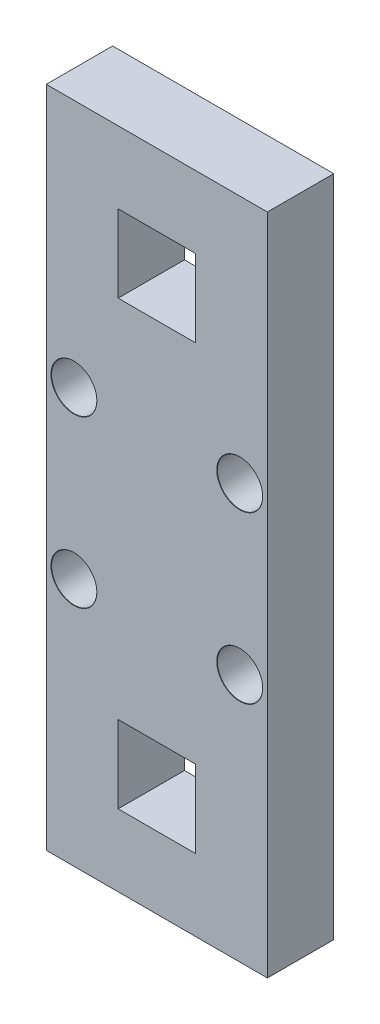
from build123d import *

# Parameters (mm, degrees)
SKETCH_1_W                        = 20
SKETCH_1_H                        = 60
EXTRUDE_1_DEPTH                   = 6
SKETCH_2_W                        = 7
SKETCH_2_H                        = 7
CUT_EXTRUDE_1_DEPTH               = 10
HOLE_WIZARD_4_1_4_1_1_D           = 4.1
HOLE_WIZARD_4_1_4_1_1_CSINK_D     = 4.15
HOLE_WIZARD_4_1_4_1_1_CSINK_ANGLE = 90


with BuildPart() as part:
    # 草图1 → 凸台-拉伸1 (new body)
    with BuildSketch(Plane.XY):
        Rectangle(SKETCH_1_W, SKETCH_1_H)
    extrude(amount=EXTRUDE_1_DEPTH)

    # 草图2 → 切除-拉伸1 (cut)
    with BuildSketch(Plane.XY.offset(6)):
        with Locations((0, 20)):
            Rectangle(SKETCH_2_W, SKETCH_2_H)
    cut_extrude_1 = extrude(amount=-CUT_EXTRUDE_1_DEPTH, mode=Mode.SUBTRACT)

    # 镜向1: 切除-拉伸1 across plane
    add(cut_extrude_1.mirror(Plane.ZX), mode=Mode.SUBTRACT)

    # Ø4.1 (4.1) 直径孔1 (through all)
    with Locations(Plane(origin=(-7.5, 7.5, 6), x_dir=(1, 0, 0), z_dir=(0, 0, 1))):
        with Locations((0, 0), (15, 0), (15, -15), (0, -15)):
            CounterSinkHole(HOLE_WIZARD_4_1_4_1_1_D / 2, HOLE_WIZARD_4_1_4_1_1_CSINK_D / 2, counter_sink_angle=HOLE_WIZARD_4_1_4_1_1_CSINK_ANGLE)


solid = part.part
